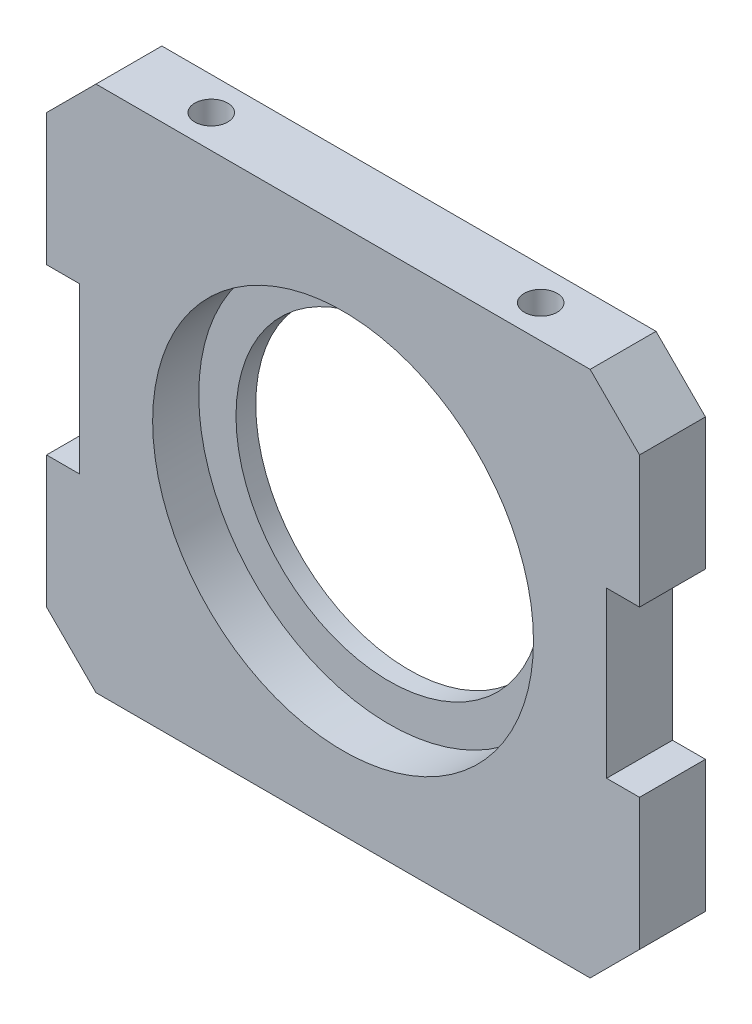
from build123d import *

# Parameters (mm, degrees)
CROQUIS1_W              = 90
CROQUIS1_H              = 80
CROQUIS1_R              = 28.9
SALIENTE_EXTRUIR1_DEPTH = 5
CROQUIS2_R              = 28.9
CROQUIS2_R_2            = 23.25
SALIENTE_EXTRUIR2_DEPTH = 3
CROQUIS4_W              = 10
CROQUIS4_H              = 25
CORTAR_EXTRUIR2_DEPTH   = 62.032778079
CHAFL_N2_SIZE           = 7.5
CROQUIS9_R              = 2.5
CORTAR_EXTRUIR3_DEPTH   = 10


with BuildPart() as part:
    # Croquis1 → Saliente-Extruir1 (new, symmetric)
    with BuildSketch(Plane.XY):
        Rectangle(CROQUIS1_W, CROQUIS1_H)
        Circle(CROQUIS1_R, mode=Mode.SUBTRACT)
    extrude(amount=SALIENTE_EXTRUIR1_DEPTH, both=True)

    # Croquis2 → Saliente-Extruir2 (add)
    with BuildSketch(Plane(origin=(0, 0, -5), x_dir=(-1, 0, 0), z_dir=(0, 0, -1))):
        Circle(CROQUIS2_R)
        Circle(CROQUIS2_R_2, mode=Mode.SUBTRACT)
    extrude(amount=-SALIENTE_EXTRUIR2_DEPTH)

    # Croquis4 → Cortar-Extruir2 (cut, through all)
    with BuildSketch(Plane.XY.offset(5)):
        with Locations((-45, 0)):
            Rectangle(CROQUIS4_W, CROQUIS4_H)
        with Locations((45, 0)):
            Rectangle(CROQUIS4_W, CROQUIS4_H)
    extrude(amount=-CORTAR_EXTRUIR2_DEPTH, mode=Mode.SUBTRACT)

    # Chaflán2
    chafl_n2_edges = [part.edges().sort_by_distance(p)[0] for p in [
        (45, -40, 0),
        (-45, -40, 0),
        (-45, 40, 0),
        (45, 40, 0),
    ]]
    chamfer(chafl_n2_edges, length=CHAFL_N2_SIZE)

    # Croquis9 → Cortar-Extruir3 (cut)
    with BuildSketch(Plane.XZ.offset(40)):
        with Locations(Location((-25, 0, 0), (0, 0, 270))):
            Circle(CROQUIS9_R)
        with Locations(Location((25, 0, 0), (0, 0, 270))):
            Circle(CROQUIS9_R)
    cortar_extruir3 = extrude(amount=-CORTAR_EXTRUIR3_DEPTH, mode=Mode.SUBTRACT)

    # Simetría1: Cortar-Extruir3 across plane
    add(cortar_extruir3.mirror(Plane.ZX), mode=Mode.SUBTRACT)


solid = part.part
